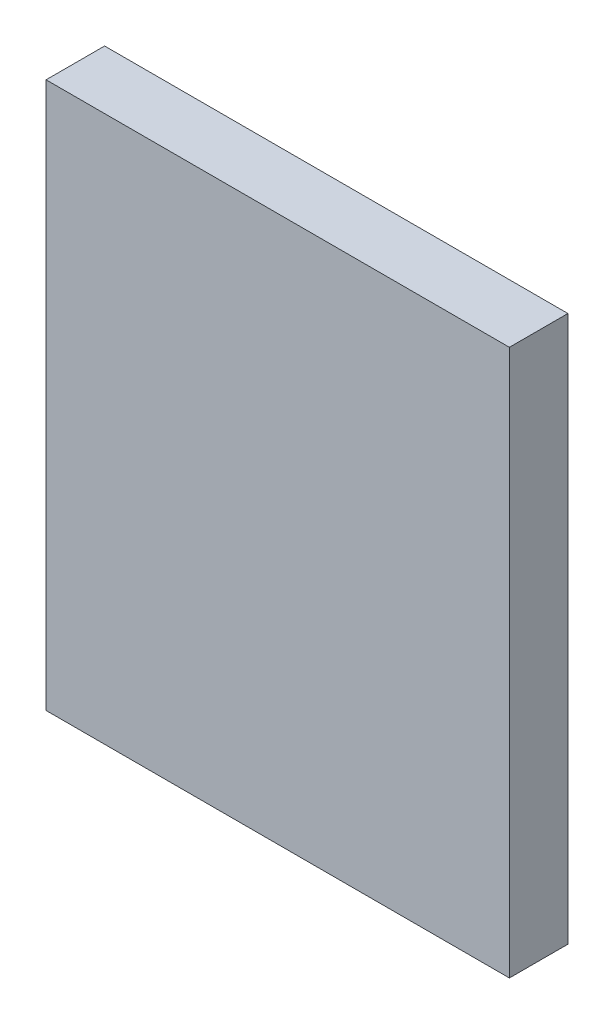
from build123d import *

# Parameters (mm, degrees)
SKETCH1_W           = 9.5
SKETCH1_H           = 11.2
BOSS_EXTRUDE1_DEPTH = 1.2


with BuildPart() as part:
    # Sketch1 → Boss-Extrude1 (new body)
    with BuildSketch(Plane.XY):
        with Locations((4.75, 5.6)):
            Rectangle(SKETCH1_W, SKETCH1_H)
    extrude(amount=BOSS_EXTRUDE1_DEPTH)


solid = part.part
